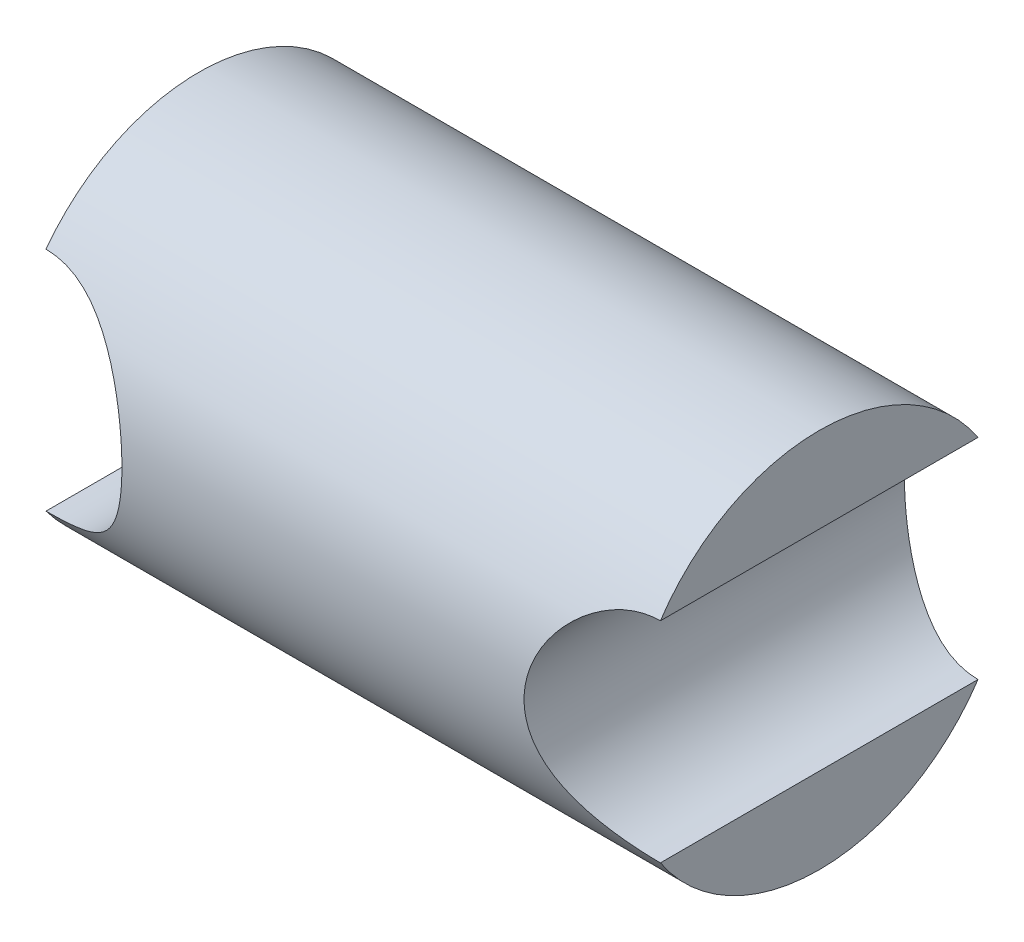
from build123d import *

# Parameters (mm, degrees)
SKETCH1_R                           = 23
BOSS_EXTRUDE1_DEPTH                 = 75
CUT_EXTRUDE1_REACH                  = 83.75
CUT_EXTRUDE1_END_RADIUS             = 23
SKETCH2_R                           = 13.709861361
SKETCH2_R_2                         = 12.670153282
CUT_EXTRUDE1_DIRECTION_2_REACH      = 83.75
CUT_EXTRUDE1_DIRECTION_2_END_RADIUS = 23


with BuildPart() as part:
    # Sketch1 → Boss-Extrude1 (new body)
    with BuildSketch(Plane(origin=(0, 0, 0), x_dir=(0, 0, -1), z_dir=(1, 0, 0))):
        Circle(SKETCH1_R)
    extrude(amount=BOSS_EXTRUDE1_DEPTH)

    # Cut-Extrude1: up to this cylinder (the profile starts inside it)
    cut_extrude1_end = Plane(origin=(37.49105, 0, 0), z_dir=(-1, 0, 0)) * Cylinder(CUT_EXTRUDE1_END_RADIUS, 289.4821, mode=Mode.PRIVATE)
    # Sketch2 → Cut-Extrude1 (cut, up to the surface)
    with BuildSketch(Plane.XY, mode=Mode.PRIVATE) as cut_extrude1_sk1:
        Circle(SKETCH2_R)
    cut_extrude1_tool1 = extrude(cut_extrude1_sk1.sketch, amount=-CUT_EXTRUDE1_REACH, mode=Mode.PRIVATE) & cut_extrude1_end
    add(cut_extrude1_tool1.solids().sort_by_distance((0, 0, 0))[0], mode=Mode.SUBTRACT)
    # Sketch2 → Cut-Extrude1 (cut, up to the surface)
    with BuildSketch(Plane.XY, mode=Mode.PRIVATE) as cut_extrude1_sk2:
        with Locations((74.982099517, 0)):
            Circle(SKETCH2_R_2)
    cut_extrude1_tool2 = extrude(cut_extrude1_sk2.sketch, amount=-CUT_EXTRUDE1_REACH, mode=Mode.PRIVATE) & cut_extrude1_end
    add(cut_extrude1_tool2.solids().sort_by_distance((74.9821, 0, 0))[0], mode=Mode.SUBTRACT)

    # Cut-Extrude1 direction 2: up to this cylinder (the profile starts inside it)
    cut_extrude1_direction_2_end = Plane(origin=(37.49105, 0, 0), z_dir=(-1, 0, 0)) * Cylinder(CUT_EXTRUDE1_DIRECTION_2_END_RADIUS, 289.4821, mode=Mode.PRIVATE)
    # Sketch2 → Cut-Extrude1 direction 2 (cut, up to the surface)
    with BuildSketch(Plane.XY, mode=Mode.PRIVATE) as cut_extrude1_direction_2_sk1:
        Circle(SKETCH2_R)
    cut_extrude1_direction_2_tool1 = extrude(cut_extrude1_direction_2_sk1.sketch, amount=CUT_EXTRUDE1_DIRECTION_2_REACH, mode=Mode.PRIVATE) & cut_extrude1_direction_2_end
    add(cut_extrude1_direction_2_tool1.solids().sort_by_distance((0, 0, 0))[0], mode=Mode.SUBTRACT)
    # Sketch2 → Cut-Extrude1 direction 2 (cut, up to the surface)
    with BuildSketch(Plane.XY, mode=Mode.PRIVATE) as cut_extrude1_direction_2_sk2:
        with Locations((74.982099517, 0)):
            Circle(SKETCH2_R_2)
    cut_extrude1_direction_2_tool2 = extrude(cut_extrude1_direction_2_sk2.sketch, amount=CUT_EXTRUDE1_DIRECTION_2_REACH, mode=Mode.PRIVATE) & cut_extrude1_direction_2_end
    add(cut_extrude1_direction_2_tool2.solids().sort_by_distance((74.9821, 0, 0))[0], mode=Mode.SUBTRACT)


solid = part.part
